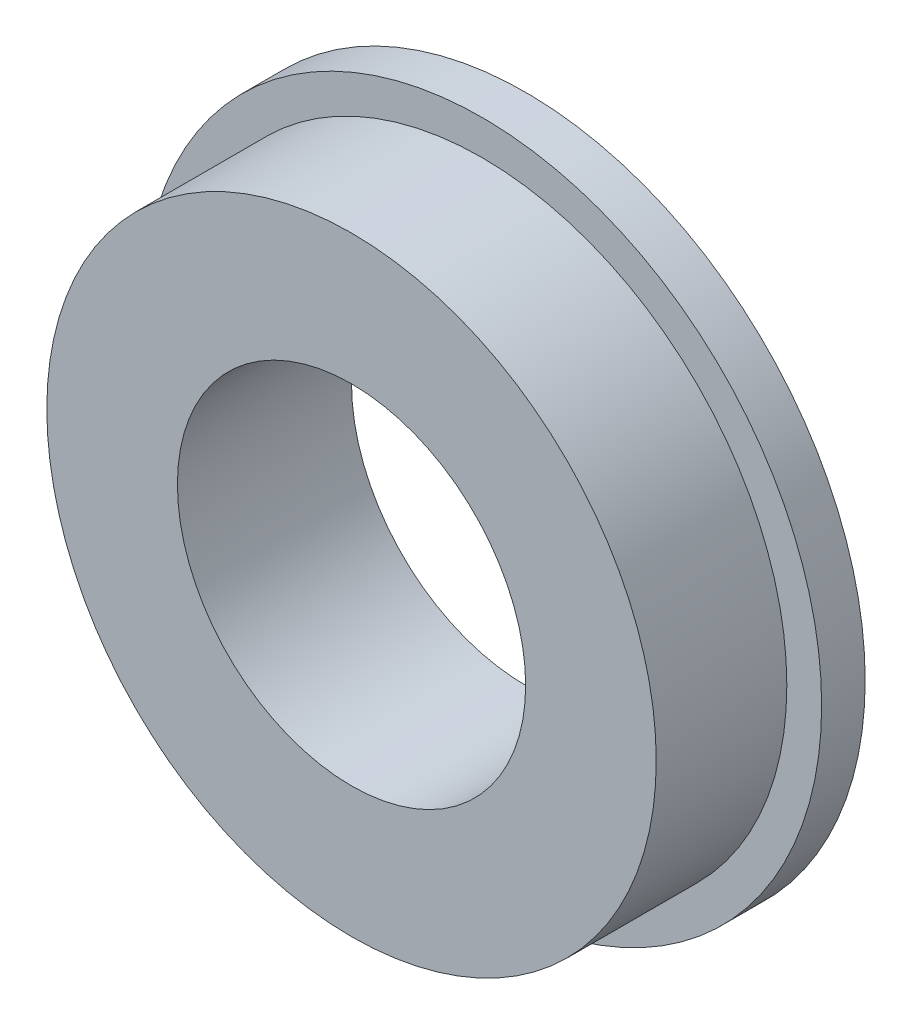
from build123d import *

# Parameters (mm, degrees)
SKETCH_1_R          = 7.8
EXTRUDE_1_DEPTH     = 1
SKETCH_2_R          = 7
EXTRUDE_2_DEPTH     = 3
SKETCH_3_R          = 4
CUT_EXTRUDE_1_DEPTH = 5


with BuildPart() as part:
    # 草图1 → 凸台-拉伸1 (new body)
    with BuildSketch(Plane.XY):
        Circle(SKETCH_1_R)
    extrude(amount=EXTRUDE_1_DEPTH)

    # 草图2 → 凸台-拉伸2 (add)
    with BuildSketch(Plane.XY.offset(1)):
        Circle(SKETCH_2_R)
    extrude(amount=EXTRUDE_2_DEPTH)

    # 草图3 → 切除-拉伸1 (cut)
    with BuildSketch(Plane(origin=(0, 0, 0), x_dir=(-1, 0, 0), z_dir=(0, 0, -1))):
        Circle(SKETCH_3_R)
    extrude(amount=-CUT_EXTRUDE_1_DEPTH, mode=Mode.SUBTRACT)


solid = part.part
